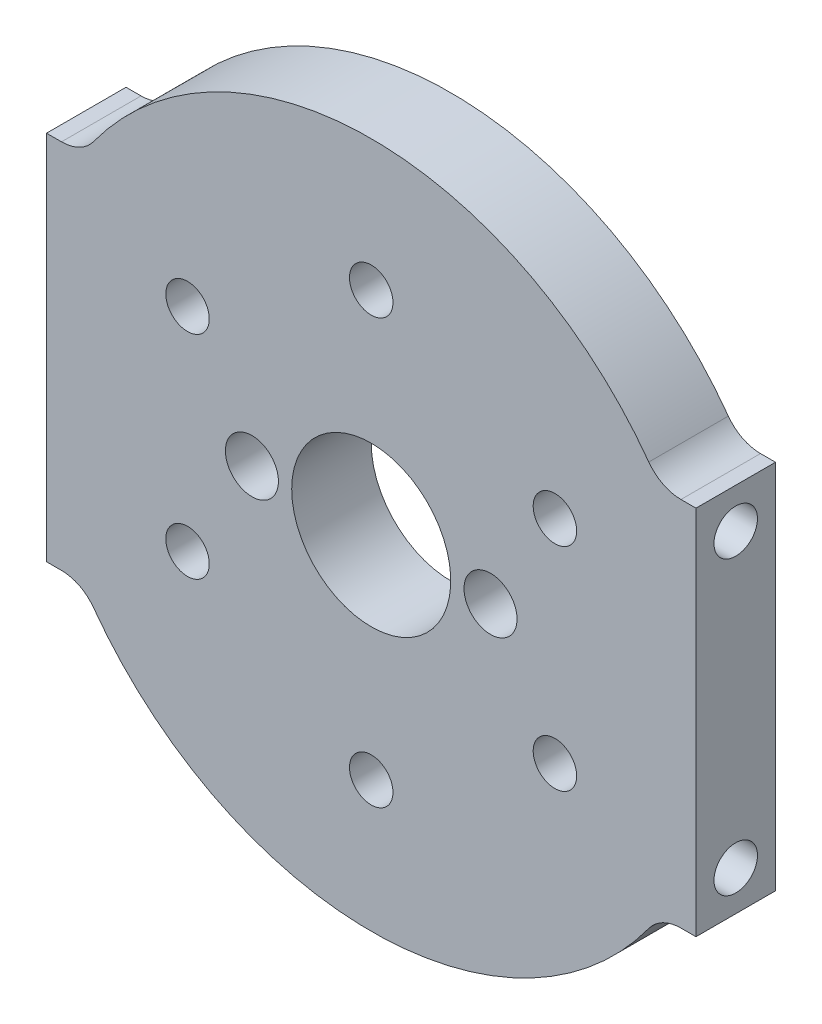
from build123d import *

# Parameters (mm, degrees)
SKETCH1_R           = 3.175
SKETCH1_R_2         = 9.525
SKETCH1_R_3         = 2.6035
BOSS_EXTRUDE1_DEPTH = 9.525
SKETCH2_R           = 2.6035
CUT_EXTRUDE1_DEPTH  = 12.7


with BuildPart() as part:
    # Sketch1 → Boss-Extrude1 (new body)
    with BuildSketch(Plane.XY.offset(200.726675)):
        with BuildLine():
            Line((-37.090603219, 784.981140976), (-38.887083386, 784.981140976))
            Line((-38.887083386, 784.981140976), (-38.887083386, 740.531140976))
            Line((-38.887083386, 740.531140976), (-37.090603219, 740.531140976))
            ThreePointArc((-37.090603219, 740.531140976), (-34.929955448, 740.01281433), (-33.23961584, 738.570658545))
            ThreePointArc((-33.23961584, 738.570658545), (0, 721.648846957), (33.23961584, 738.570658545))
            ThreePointArc((33.23961584, 738.570658545), (34.929955448, 740.01281433), (37.090603219, 740.531140976))
            Line((37.090603219, 740.531140976), (38.887083386, 740.531140976))
            Line((38.887083386, 740.531140976), (38.887083386, 784.981140976))
            Line((38.887083386, 784.981140976), (37.090603219, 784.981140976))
            ThreePointArc((37.090603219, 784.981140976), (34.929955448, 785.499467621), (33.23961584, 786.941623406))
            ThreePointArc((33.23961584, 786.941623406), (0, 803.863434995), (-33.23961584, 786.941623406))
            ThreePointArc((-33.23961584, 786.941623406), (-34.929955448, 785.499467621), (-37.090603219, 784.981140976))
        make_face()
        with Locations(Location((14.2875, 762.756140976, 0), (0, 0, 180))):
            Circle(SKETCH1_R, mode=Mode.SUBTRACT)
        with Locations(Location((-14.2875, 762.756140976, 0), (0, 0, 180))):
            Circle(SKETCH1_R, mode=Mode.SUBTRACT)
        with Locations(Location((0, 762.756140976, 0), (0, 0, 180))):
            Circle(SKETCH1_R_2, mode=Mode.SUBTRACT)
        with Locations(Location((0, 788.156140976, 0), (0, 0, 180))):
            Circle(SKETCH1_R_3, mode=Mode.SUBTRACT)
        with Locations(Location((-21.997045256, 775.456140976, 0), (0, 0, 180))):
            Circle(SKETCH1_R_3, mode=Mode.SUBTRACT)
        with Locations(Location((-21.997045256, 750.056140976, 0), (0, 0, 180))):
            Circle(SKETCH1_R_3, mode=Mode.SUBTRACT)
        with Locations(Location((0, 737.356140976, 0), (0, 0, 180))):
            Circle(SKETCH1_R_3, mode=Mode.SUBTRACT)
        with Locations(Location((21.997045256, 750.056140976, 0), (0, 0, 180))):
            Circle(SKETCH1_R_3, mode=Mode.SUBTRACT)
        with Locations(Location((21.997045256, 775.456140976, 0), (0, 0, 180))):
            Circle(SKETCH1_R_3, mode=Mode.SUBTRACT)
    extrude(amount=BOSS_EXTRUDE1_DEPTH)

    # Sketch2 → Cut-Extrude1 (cut)
    with BuildSketch(Plane.ZY.offset(38.887083386)):
        with Locations(Location((205.489175, 780.218640976, 0), (0, 0, 270))):
            Circle(SKETCH2_R)
        with Locations(Location((205.489175, 745.293640976, 0), (0, 0, 90))):
            Circle(SKETCH2_R)
    cut_extrude1 = extrude(amount=-CUT_EXTRUDE1_DEPTH, mode=Mode.SUBTRACT)

    # Mirror1: Cut-Extrude1 across plane
    add(cut_extrude1.mirror(Plane(origin=(0, 0, 0), x_dir=(0, 0, 1), z_dir=(1, 0, 0))), mode=Mode.SUBTRACT)


solid = part.part
